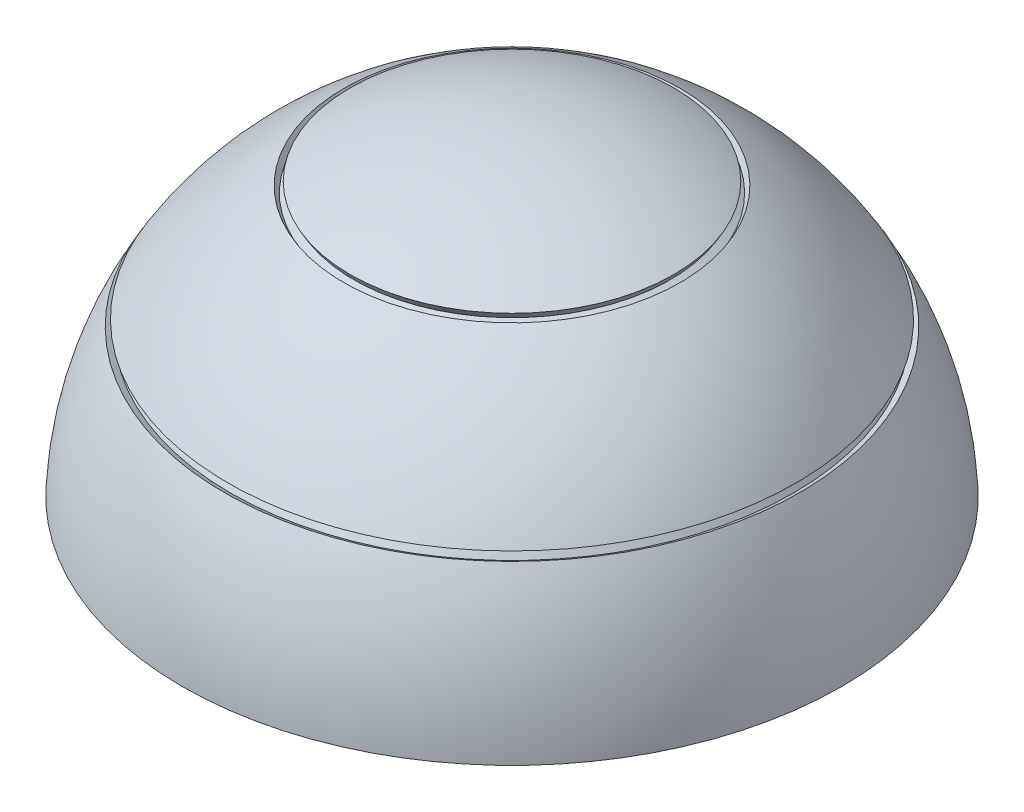
from build123d import *

# Parameters (mm, degrees)
REVOLVE1_ANGLE     = 180
SKETCH2_R          = 44.45
CUT_EXTRUDE1_DEPTH = 2
F_30DEG_W          = 1
F_30DEG_H          = 1


with BuildPart() as part:
    # Sketch1 → Revolve1 (revolve)
    with BuildSketch(Plane(origin=(0, 0, 0), x_dir=(1, 0, 0), z_dir=(0, 1, 0))):
        with BuildLine():
            ThreePointArc((0, 44.45), (-44.45, 0), (0, -44.45))
            Line((0, -44.45), (0, -42.45))
            ThreePointArc((0, -42.45), (-42.45, 0), (0, 42.45))
            Line((0, 42.45), (0, 44.45))
        make_face()
    revolve(axis=Axis((0, 0, 44.45), (0, 0, -1)), revolution_arc=REVOLVE1_ANGLE)

    # Sketch2 → Cut-Extrude1 (cut)
    with BuildSketch(Plane(origin=(0, 0, 0), x_dir=(1, 0, 0), z_dir=(0, 1, 0))):
        Circle(SKETCH2_R)
    extrude(amount=CUT_EXTRUDE1_DEPTH, mode=Mode.SUBTRACT)

    # 30deg → Cut-Revolve1 (revolve, cut)
    with BuildSketch(Plane(origin=(0, 0, 0), x_dir=(0, 0, -1), z_dir=(1, 0, 0))):
        with Locations((43.95, 0)):
            Rectangle(F_30DEG_W, F_30DEG_H)
        Polygon((38.244829198, 22.658012702), (38.744829198, 21.791987298), (37.878803794, 21.291987298), (37.378803794, 22.158012702), align=None)
        Polygon((21.791987298, 38.744829198), (22.658012702, 38.244829198), (22.158012702, 37.378803794), (21.291987298, 37.878803794), align=None)
    revolve(axis=Axis((0, -1000, 0), (0, 1, 0)), mode=Mode.SUBTRACT)


solid = part.part
